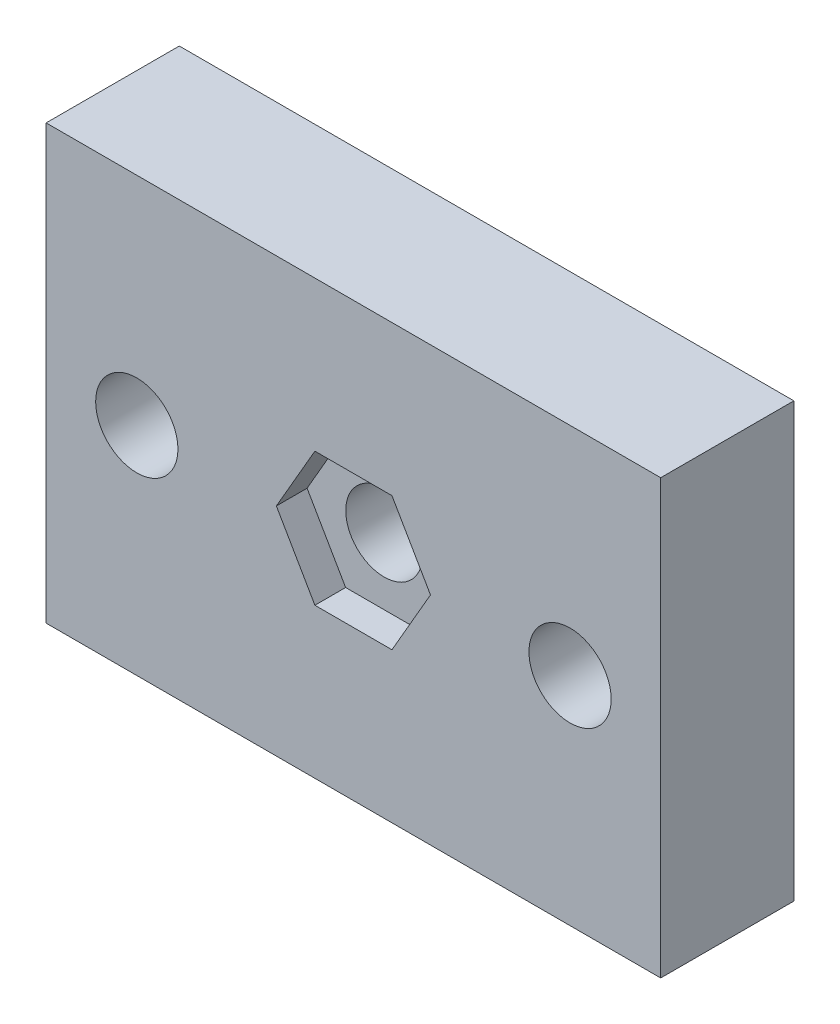
from build123d import *

# Parameters (mm, degrees)
SKETCH2_W           = 60
SKETCH2_H           = 42.3
BOSS_EXTRUDE1_DEPTH = 13
SKETCH3_R           = 4.015
CUT_EXTRUDE1_DEPTH  = 10
CUT_EXTRUDE2_DEPTH  = 3
SKETCH5_R           = 3.75
CUT_EXTRUDE3_DEPTH  = 41.498999822
CUT_EXTRUDE4_DEPTH  = 3


with BuildPart() as part:
    # Sketch2 → Boss-Extrude1 (new body)
    with BuildSketch(Plane.XY):
        with Locations((1.553418124, -2.185612083)):
            Rectangle(SKETCH2_W, SKETCH2_H)
    extrude(amount=BOSS_EXTRUDE1_DEPTH)

    # Sketch3 → Cut-Extrude1 (cut)
    with BuildSketch(Plane.XY.offset(13)):
        with Locations((22.703418124, -2.185612083)):
            Circle(SKETCH3_R)
        with Locations(Location((-19.596581876, -2.185612083, 0), (0, 0, 180))):
            Circle(SKETCH3_R)
    extrude(amount=-CUT_EXTRUDE1_DEPTH, mode=Mode.SUBTRACT)

    # Sketch4 → Cut-Extrude2 (cut)
    with BuildSketch(Plane.XY.offset(13)):
        Polygon((9.076292132, -2.185612083), (5.314855128, 4.329387917), (-2.20801888, 4.329387917), (-5.969455884, -2.185612083), (-2.20801888, -8.700612083), (5.314855128, -8.700612083), align=None)
    extrude(amount=-CUT_EXTRUDE2_DEPTH, mode=Mode.SUBTRACT)

    # Sketch5 → Cut-Extrude3 (cut, through all)
    with BuildSketch(Plane.XY.offset(10)):
        with Locations((1.553418124, -2.185612083)):
            Circle(SKETCH5_R)
    extrude(amount=-CUT_EXTRUDE3_DEPTH, mode=Mode.SUBTRACT)

    # Sketch6 → Cut-Extrude4 (cut)
    with BuildSketch(Plane(origin=(0, 0, 0), x_dir=(-1, 0, 0), z_dir=(0, 0, -1))):
        Polygon((5.969455884, -2.185612083), (2.20801888, 4.329387917), (-5.314855128, 4.329387917), (-9.076292132, -2.185612083), (-5.314855128, -8.700612083), (2.20801888, -8.700612083), align=None)
    extrude(amount=-CUT_EXTRUDE4_DEPTH, mode=Mode.SUBTRACT)


solid = part.part
